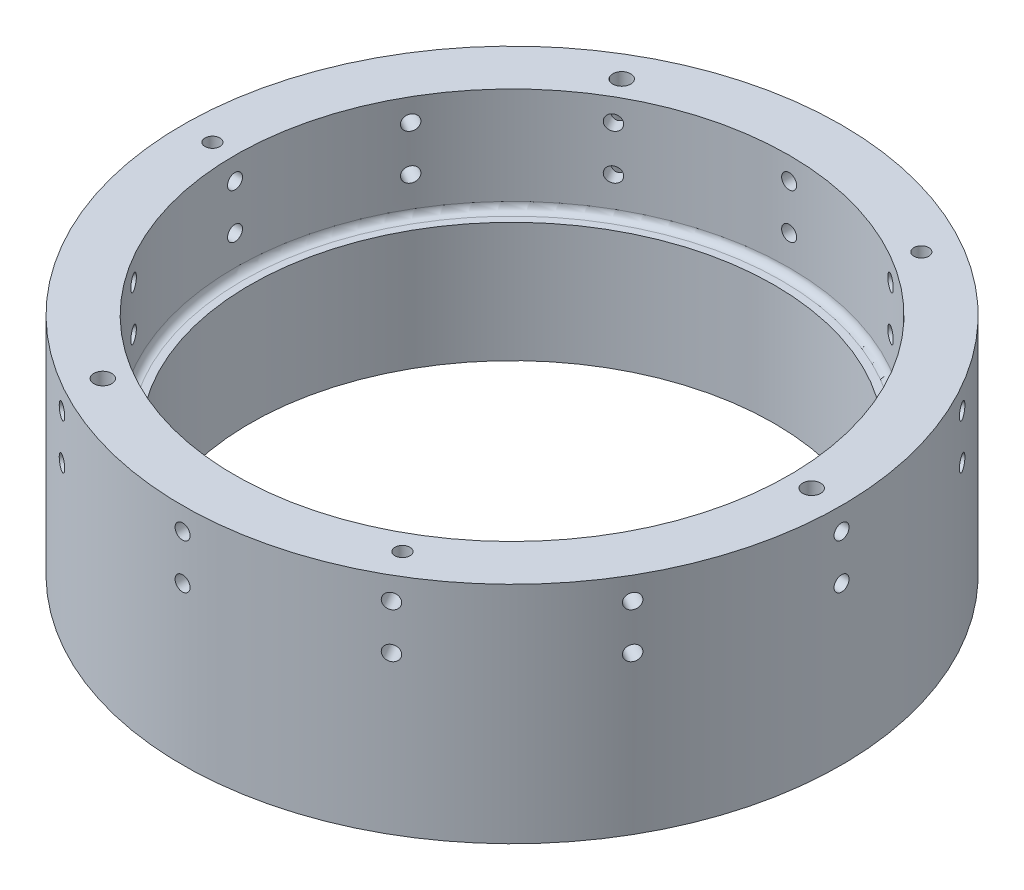
from build123d import *
from build123d.topology import SkipClean

# Parameters (mm, degrees)
SKETCH_2_R                  = 3.000000000000008
CUT_EXTRUDE_1_DEPTH         = 173.69916039170545
HOLE_WIZARD_M6_3_AT_2_COUNT = 2
HOLE_WIZARD_M6_3_AT_2_PITCH = 15
SKETCH_9_R                  = 2.499999999999995
CUT_EXTRUDE_2_DEPTH         = 173.69916056252345
PATTERN_CIRCULAR_1_COUNT    = 3
FILLET_1_R                  = 2.5
PATTERN_CIRCULAR_2_COUNT    = 12


with BuildPart() as part:
    # 草图1 → 旋转1 (revolve)
    with BuildSketch(Plane(origin=(0, 0, 0), x_dir=(0, 0, -1), z_dir=(1, 0, 0)), mode=Mode.PRIVATE) as revolve_1_sk:
        Polygon((-110.00000000000001, 75), (-109.99999999999999, 0), (-87.5, 0), (-87.5, 40), (-92.5, 39.99999999999999), (-92.5, 75), align=None)
    revolve(revolve_1_sk.sketch.rotate(Axis((0, 0, 0), (0, 1, 0)), 180), axis=Axis((0, 0, 0), (0, 1, 0)))

    # 草图2 → 切除-拉伸1 (cut, through all)
    with BuildSketch(Plane(origin=(0, 75, 0), x_dir=(1, 0, 0), z_dir=(0, 1, 0))):
        with Locations(Location((100, 0, 0), (0, 0, 270))):
            Circle(SKETCH_2_R)
    cut_extrude_1 = extrude(amount=-CUT_EXTRUDE_1_DEPTH, mode=Mode.SUBTRACT)

    # 草图4 → M6 螺纹孔1 (revolve, cut)
    with BuildSketch(Plane(origin=(-100, 75, 0), x_dir=(0, 0, 1), z_dir=(1, 0, 0))):
        Polygon((0, 0), (-4.04e-15, 16.5021515475689), (2.4999999999999867, 15), (2.4999999999999902, -1.25e-15), align=None)
    hole_wizard_m6_1 = revolve(axis=Axis((-100, 81.35, 0), (0, -1, 0)), mode=Mode.SUBTRACT)

    # 草图6 → M6 螺纹孔2 (revolve, cut)
    with BuildSketch(Plane(origin=(-100, 0, 0), x_dir=(0, 0, -1), z_dir=(1, 0, 0))):
        Polygon((0, 0), (-4.04e-15, 16.5021515475689), (2.4999999999999885, 15), (2.4999999999999902, -1.25e-15), align=None)
    hole_wizard_m6_2 = revolve(axis=Axis((-100, -6.349999999999991, 0), (0, 1, 0)), mode=Mode.SUBTRACT)

    # 草图8 → M6 螺纹孔3 (revolve, cut)
    with BuildSketch(Plane(origin=(0, 67.5, 0), x_dir=(0, 1, 0), z_dir=(1, 0, 0))):
        Polygon((0, 0), (-2.694e-14, 110.00000000000117), (2.4999999999999685, 110.00000000000117), (2.4999999999999885, -1.25e-15), align=None)
    hole_wizard_m6_3 = revolve(axis=Axis((0, 67.5, -6.349999999999991), (0, 0, 1)), mode=Mode.SUBTRACT)

    # M6 螺纹孔3 at 2: M6 螺纹孔3 ×2
    with Locations(*[(0, -i * HOLE_WIZARD_M6_3_AT_2_PITCH, 0) for i in range(1, HOLE_WIZARD_M6_3_AT_2_COUNT)]):
        add(hole_wizard_m6_3, mode=Mode.SUBTRACT)

    # 草图9 → 切除-拉伸2 (cut, through all)
    with BuildSketch(Plane(origin=(0, 75, 0), x_dir=(1, 0, 0), z_dir=(0, 1, 0))):
        with Locations(Location((-100, 0, 0), (0, 0, 270))):
            Circle(SKETCH_9_R)
    cut_extrude_2 = extrude(amount=-CUT_EXTRUDE_2_DEPTH, mode=Mode.SUBTRACT)

    # 阵列(圆周)1: 切除-拉伸1, M6 螺纹孔1, M6 螺纹孔2, 切除-拉伸2 ×3 about axis
    pattern_circular_1_axis = Axis((-5.74e-15, 0, 5.94e-15), (0, 1, 0))
    add([cut_extrude_1.rotate(pattern_circular_1_axis, i * 360 / PATTERN_CIRCULAR_1_COUNT) for i in range(1, PATTERN_CIRCULAR_1_COUNT)], mode=Mode.SUBTRACT)
    add([hole_wizard_m6_1.rotate(pattern_circular_1_axis, i * 360 / PATTERN_CIRCULAR_1_COUNT) for i in range(1, PATTERN_CIRCULAR_1_COUNT)], mode=Mode.SUBTRACT)
    add([hole_wizard_m6_2.rotate(pattern_circular_1_axis, i * 360 / PATTERN_CIRCULAR_1_COUNT) for i in range(1, PATTERN_CIRCULAR_1_COUNT)], mode=Mode.SUBTRACT)
    add([cut_extrude_2.rotate(pattern_circular_1_axis, i * 360 / PATTERN_CIRCULAR_1_COUNT) for i in range(1, PATTERN_CIRCULAR_1_COUNT)], mode=Mode.SUBTRACT)

    # 圆角1
    fillet_1_edges = [part.edges().sort_by_distance(p)[0] for p in [
        (-2.266e-14, 39.99999999999999, 92.5),
    ]]
    fillet(fillet_1_edges, radius=FILLET_1_R)

    # 阵列(圆周)2: M6 螺纹孔3 ×12 about axis
    pattern_circular_2_axis = Axis((0, 0, 0), (0, -1, 0))
    for i in range(1, PATTERN_CIRCULAR_2_COUNT):
        add(hole_wizard_m6_3.rotate(pattern_circular_2_axis, i * 360 / PATTERN_CIRCULAR_2_COUNT), mode=Mode.SUBTRACT)

    # 阵列(圆周)2 copy 1 sketch → 阵列(圆周)2 copy 1 (revolve, cut)
    with BuildSketch(Plane(origin=(0, 52.5, 0), x_dir=(0, 1, 0), z_dir=(0.8660254037844387, 0, 0.49999999999999994))):
        Polygon((0, 0), (-2.694e-14, 110.00000000000117), (2.4999999999999685, 110.00000000000117), (2.4999999999999885, -1.25e-15), align=None)
    revolve(axis=Axis((3.174999999999995, 52.5, -5.499261314031178), (-0.49999999999999994, 0, 0.8660254037844387)), mode=Mode.SUBTRACT)

    # 阵列(圆周)2 copy 2 sketch → 阵列(圆周)2 copy 2 (revolve, cut)
    with BuildSketch(Plane(origin=(0, 52.5, 0), x_dir=(0, 1, 0), z_dir=(0.5000000000000001, 0, 0.8660254037844386))):
        Polygon((0, 0), (-2.694e-14, 110.00000000000117), (2.4999999999999685, 110.00000000000117), (2.4999999999999885, -1.25e-15), align=None)
    revolve(axis=Axis((5.499261314031177, 52.5, -3.1749999999999963), (-0.8660254037844386, 0, 0.5000000000000001)), mode=Mode.SUBTRACT)

    # 阵列(圆周)2 copy 3 sketch → 阵列(圆周)2 copy 3 (revolve, cut)
    with SkipClean():  # the faces are left unmerged after this step: merging them gives an invalid solid
        with BuildSketch(Plane(origin=(0, 52.5, 0), x_dir=(0, 1, 0), z_dir=(6e-17, 0, 1))):
            Polygon((0, 0), (-2.694e-14, 110.00000000000117), (2.4999999999999685, 110.00000000000117), (2.4999999999999885, -1.25e-15), align=None)
        revolve(axis=Axis((6.349999999999991, 52.5, -3.9e-16), (-1, 0, 6e-17)), mode=Mode.SUBTRACT)

    # 阵列(圆周)2 copy 4 sketch → 阵列(圆周)2 copy 4 (revolve, cut)
    with SkipClean():  # the faces are left unmerged after this step: merging them gives an invalid solid
        with BuildSketch(Plane(origin=(0, 52.5, 0), x_dir=(0, 1, 0), z_dir=(-0.4999999999999998, 0, 0.8660254037844387))):
            Polygon((0, 0), (-2.694e-14, 110.00000000000117), (2.4999999999999685, 110.00000000000117), (2.4999999999999885, -1.25e-15), align=None)
        revolve(axis=Axis((5.499261314031178, 52.5, 3.174999999999994), (-0.8660254037844387, 0, -0.4999999999999998)), mode=Mode.SUBTRACT)

    # 阵列(圆周)2 copy 5 sketch → 阵列(圆周)2 copy 5 (revolve, cut)
    with SkipClean():  # the faces are left unmerged after this step: merging them gives an invalid solid
        with BuildSketch(Plane(origin=(0, 52.5, 0), x_dir=(0, 1, 0), z_dir=(-0.8660254037844387, 0, 0.49999999999999994))):
            Polygon((0, 0), (-2.694e-14, 110.00000000000117), (2.4999999999999685, 110.00000000000117), (2.4999999999999885, -1.25e-15), align=None)
        revolve(axis=Axis((3.174999999999995, 52.5, 5.499261314031178), (-0.49999999999999994, 0, -0.8660254037844387)), mode=Mode.SUBTRACT)

    # 阵列(圆周)2 copy 6 sketch → 阵列(圆周)2 copy 6 (revolve, cut)
    with SkipClean():  # the faces are left unmerged after this step: merging them gives an invalid solid
        with BuildSketch(Plane(origin=(0, 52.5, 0), x_dir=(0, 1, 0), z_dir=(-1, 0, 1.2e-16))):
            Polygon((0, 0), (-2.694e-14, 110.00000000000117), (2.4999999999999685, 110.00000000000117), (2.4999999999999885, -1.25e-15), align=None)
        revolve(axis=Axis((7.8e-16, 52.5, 6.349999999999991), (-1.2e-16, 0, -1)), mode=Mode.SUBTRACT)

    # 阵列(圆周)2 copy 7 sketch → 阵列(圆周)2 copy 7 (revolve, cut)
    with SkipClean():  # the faces are left unmerged after this step: merging them gives an invalid solid
        with BuildSketch(Plane(origin=(0, 52.5, 0), x_dir=(0, 1, 0), z_dir=(-0.8660254037844386, 0, -0.5000000000000001))):
            Polygon((0, 0), (-2.694e-14, 110.00000000000117), (2.4999999999999685, 110.00000000000117), (2.4999999999999885, -1.25e-15), align=None)
        revolve(axis=Axis((-3.1749999999999963, 52.5, 5.499261314031177), (0.5000000000000001, 0, -0.8660254037844386)), mode=Mode.SUBTRACT)

    # 阵列(圆周)2 copy 8 sketch → 阵列(圆周)2 copy 8 (revolve, cut)
    with SkipClean():  # the faces are left unmerged after this step: merging them gives an invalid solid
        with BuildSketch(Plane(origin=(0, 52.5, 0), x_dir=(0, 1, 0), z_dir=(-0.5000000000000004, 0, -0.8660254037844384))):
            Polygon((0, 0), (-2.694e-14, 110.00000000000117), (2.4999999999999685, 110.00000000000117), (2.4999999999999885, -1.25e-15), align=None)
        revolve(axis=Axis((-5.499261314031176, 52.5, 3.174999999999998), (0.8660254037844384, 0, -0.5000000000000004)), mode=Mode.SUBTRACT)

    # 阵列(圆周)2 copy 9 sketch → 阵列(圆周)2 copy 9 (revolve, cut)
    with SkipClean():  # the faces are left unmerged after this step: merging them gives an invalid solid
        with BuildSketch(Plane(origin=(0, 52.5, 0), x_dir=(0, 1, 0), z_dir=(-1.8e-16, 0, -1))):
            Polygon((0, 0), (-2.694e-14, 110.00000000000117), (2.4999999999999685, 110.00000000000117), (2.4999999999999885, -1.25e-15), align=None)
        revolve(axis=Axis((-6.349999999999991, 52.5, 1.17e-15), (1, 0, -1.8e-16)), mode=Mode.SUBTRACT)

    # 阵列(圆周)2 copy 10 sketch → 阵列(圆周)2 copy 10 (revolve, cut)
    with SkipClean():  # the faces are left unmerged after this step: merging them gives an invalid solid
        with BuildSketch(Plane(origin=(0, 52.5, 0), x_dir=(0, 1, 0), z_dir=(0.5000000000000001, 0, -0.8660254037844386))):
            Polygon((0, 0), (-2.694e-14, 110.00000000000117), (2.4999999999999685, 110.00000000000117), (2.4999999999999885, -1.25e-15), align=None)
        revolve(axis=Axis((-5.499261314031177, 52.5, -3.1749999999999963), (0.8660254037844386, 0, 0.5000000000000001)), mode=Mode.SUBTRACT)

    # 阵列(圆周)2 copy 11 sketch → 阵列(圆周)2 copy 11 (revolve, cut)
    with SkipClean():  # the faces are left unmerged after this step: merging them gives an invalid solid
        with BuildSketch(Plane(origin=(0, 52.5, 0), x_dir=(0, 1, 0), z_dir=(0.8660254037844384, 0, -0.5000000000000004))):
            Polygon((0, 0), (-2.694e-14, 110.00000000000117), (2.4999999999999685, 110.00000000000117), (2.4999999999999885, -1.25e-15), align=None)
        revolve(axis=Axis((-3.174999999999998, 52.5, -5.499261314031176), (0.5000000000000004, 0, 0.8660254037844384)), mode=Mode.SUBTRACT)


solid = part.part
